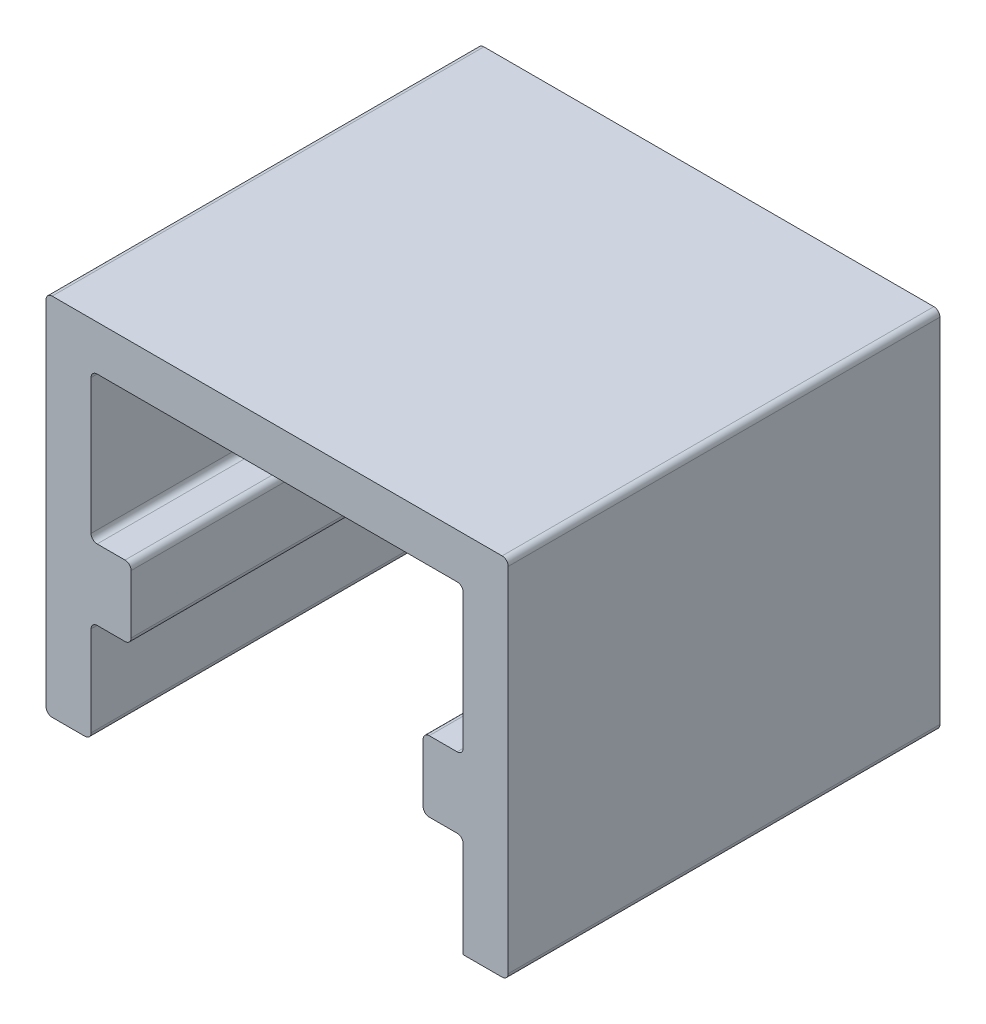
from build123d import *

# Parameters (mm, degrees)
SKETCH1_W                                         = 48.26
SKETCH1_H                                         = 38.1
BOSS_EXTRUDE1_DEPTH                               = 10.16
BOSS_EXTRUDE3_DEPTH                               = 34.925
CBORE_FOR_5_16_SOCKET_HEAD_CAP_SCREW1_D           = 8.2042
CBORE_FOR_5_16_SOCKET_HEAD_CAP_SCREW1_CBORE_D     = 13.49502
CBORE_FOR_5_16_SOCKET_HEAD_CAP_SCREW1_CBORE_DEPTH = 5.3975
SKETCH7_R                                         = 5.715
CUT_EXTRUDE2_DEPTH                                = 1.905
SKETCH8_W                                         = 4.182361547
SKETCH8_H                                         = 7.366
BOSS_EXTRUDE4_DEPTH                               = 34.925
FILLET2_R                                         = 0.635
FILLET3_R                                         = 0.635
FILLET1_R                                         = 0.635


with BuildPart() as part:
    # Sketch1 → Boss-Extrude1 (new body)
    with BuildSketch(Plane.XY):
        Rectangle(SKETCH1_W, SKETCH1_H)
    extrude(amount=BOSS_EXTRUDE1_DEPTH)

    # Sketch5 → Boss-Extrude3 (add)
    with BuildSketch(Plane.XY.offset(10.16)):
        Polygon((-24.13, -19.05), (-24.13, 19.05), (24.13, 19.05), (24.13, -19.05), (19.431, -19.05), (19.431, 14.351), (-19.431, 14.351), (-19.431, -19.05), align=None)
    extrude(amount=BOSS_EXTRUDE3_DEPTH)

    # CBORE for 5/16 Socket Head Cap Screw1 (through all)
    with Locations(Plane(origin=(0, 0, 0), x_dir=(-1, 0, 0), z_dir=(0, 0, -1))):
        with Locations((0, -4.699)):
            CounterBoreHole(CBORE_FOR_5_16_SOCKET_HEAD_CAP_SCREW1_D / 2, CBORE_FOR_5_16_SOCKET_HEAD_CAP_SCREW1_CBORE_D / 2, CBORE_FOR_5_16_SOCKET_HEAD_CAP_SCREW1_CBORE_DEPTH)

    # Sketch7 → Cut-Extrude2 (cut)
    with BuildSketch(Plane.XY.offset(10.16)):
        with Locations((0, -4.699)):
            Circle(SKETCH7_R)
    extrude(amount=-CUT_EXTRUDE2_DEPTH, mode=Mode.SUBTRACT)

    # Sketch8 → Boss-Extrude4 (add)
    with BuildSketch(Plane.XY.offset(10.16)):
        with Locations((-17.339819227, -4.699)):
            Rectangle(SKETCH8_W, SKETCH8_H)
    boss_extrude4 = extrude(amount=BOSS_EXTRUDE4_DEPTH)

    # Fillet2
    fillet2_edges = [part.edges().sort_by_distance(p)[0] for p in [
        (-19.431, 14.351, 27.6225),
        (19.431, 14.351, 27.6225),
    ]]
    fillet(fillet2_edges, radius=FILLET2_R)

    # Fillet3
    fillet3_edges = [part.edges().sort_by_distance(p)[0] for p in [
        (-19.431, -19.05, 27.6225),
        (24.13, -19.05, 22.5425),
        (-24.13, -19.05, 22.5425),
        (-24.13, 19.05, 22.5425),
        (24.13, 19.05, 22.5425),
    ]]
    fillet(fillet3_edges, radius=FILLET3_R)

    # Mirror2: Boss-Extrude4 across plane
    add(boss_extrude4.mirror(Plane(origin=(0, 0, 0), x_dir=(0, 0, 1), z_dir=(1, 0, 0))))

    # Fillet1
    fillet1_edges = [part.edges().sort_by_distance(p)[0] for p in [
        (19.431, -1.016, 27.6225),
        (19.431, -8.382, 27.6225),
        (15.248638453, -8.382, 27.6225),
        (15.248638453, -1.016, 27.6225),
        (-15.248638453, -8.382, 27.6225),
        (-15.248638453, -1.016, 27.6225),
        (-19.431, -1.016, 27.6225),
        (-19.431, -8.382, 27.6225),
    ]]
    fillet(fillet1_edges, radius=FILLET1_R)


solid = part.part
